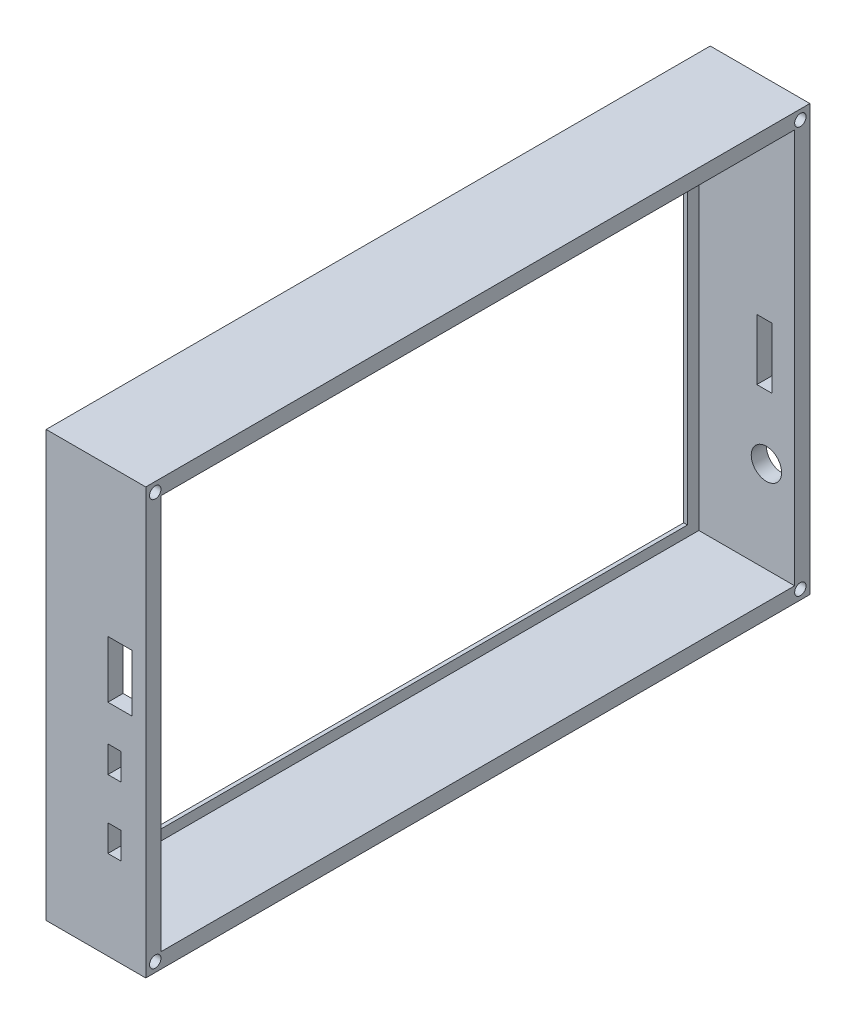
from build123d import *

# Parameters (mm, degrees)
CROQUIS1_W              = 164.9
CROQUIS1_H              = 102
SALIENTE_EXTRUIR2_DEPTH = 14.27
CROQUIS2_W              = 174.9
CROQUIS2_H              = 112
CROQUIS2_W_2            = 166.9
CROQUIS2_H_2            = 104
SALIENTE_EXTRUIR3_DEPTH = 14.27
CROQUIS3_W              = 174.9
CROQUIS3_H              = 112
CROQUIS3_W_2            = 160.9
CROQUIS3_H_2            = 98.374406292
SALIENTE_EXTRUIR5_DEPTH = 1
CROQUIS4_W              = 164.9
CROQUIS4_H              = 102
CORTAR_EXTRUIR2_DEPTH   = 14.27
CROQUIS6_W              = 174.9
CROQUIS6_H              = 112
CROQUIS6_R              = 1.5
SALIENTE_EXTRUIR6_DEPTH = 15
CROQUIS8_W              = 160.9
CROQUIS8_H              = 98.374406292
CORTAR_EXTRUIR3_DEPTH   = 9
CROQUIS9_W              = 166.9
CROQUIS9_H              = 104
CORTAR_EXTRUIR5_DEPTH   = 11
CROQUIS15_W             = 6.3
CROQUIS15_H             = 15
CROQUIS15_W_2           = 3.5
CROQUIS15_H_2           = 7
CORTAR_EXTRUIR6_DEPTH   = 7
CORTAR_EXTRUIR7_DEPTH   = 7
CROQUIS17_R             = 4
CORTAR_EXTRUIR8_DEPTH   = 7
CROQUIS18_W             = 4
CROQUIS18_H             = 16
CORTAR_EXTRUIR9_DEPTH   = 7
CROQUIS21_R             = 1.5
CORTAR_EXTRUIR12_DEPTH  = 25.4
CROQUIS22_W             = 4.034105038
CROQUIS22_H             = 112
CORTAR_EXTRUIR13_DEPTH  = 179.4


with BuildPart() as part:
    # Croquis1 → Saliente-Extruir2 (new body)
    with BuildSketch(Plane(origin=(0, 0, 0), x_dir=(0, 0, -1), z_dir=(1, 0, 0))):
        Rectangle(CROQUIS1_W, CROQUIS1_H)
    extrude(amount=SALIENTE_EXTRUIR2_DEPTH)

    # Croquis4 → Cortar-Extruir2 (cut)
    with BuildSketch(Plane(origin=(14.27, 0, 0), x_dir=(0, 0, -1), z_dir=(1, 0, 0))):
        Rectangle(CROQUIS4_W, CROQUIS4_H)
    extrude(amount=-CORTAR_EXTRUIR2_DEPTH, mode=Mode.SUBTRACT)


with BuildPart() as body_2:
    # Croquis2 → Saliente-Extruir3 (new body)
    with BuildSketch(Plane(origin=(0, 0, 0), x_dir=(0, 0, -1), z_dir=(1, 0, 0))):
        Rectangle(CROQUIS2_W, CROQUIS2_H)
        Rectangle(CROQUIS2_W_2, CROQUIS2_H_2, mode=Mode.SUBTRACT)
    extrude(amount=SALIENTE_EXTRUIR3_DEPTH)

    # Croquis3 → Saliente-Extruir5 (add)
    with BuildSketch(Plane.ZY):
        Rectangle(CROQUIS3_W, CROQUIS3_H)
        with Locations((0, -0.062203146)):
            Rectangle(CROQUIS3_W_2, CROQUIS3_H_2, mode=Mode.SUBTRACT)
    extrude(amount=SALIENTE_EXTRUIR5_DEPTH)

    # Croquis6 → Saliente-Extruir6 (add)
    with BuildSketch(Plane(origin=(14.27, 0, 0), x_dir=(0, 0, -1), z_dir=(1, 0, 0))):
        Rectangle(CROQUIS6_W, CROQUIS6_H)
        with Locations((-77.445, 46)):
            Circle(CROQUIS6_R, mode=Mode.SUBTRACT)
        with Locations((-77.445, -46)):
            Circle(CROQUIS6_R, mode=Mode.SUBTRACT)
        with Locations((-22.1, 15.81)):
            Circle(CROQUIS6_R, mode=Mode.SUBTRACT)
        with Locations((35.9, 15.81)):
            Circle(CROQUIS6_R, mode=Mode.SUBTRACT)
        with Locations((-22.1, -33.19)):
            Circle(CROQUIS6_R, mode=Mode.SUBTRACT)
        with Locations((35.9, -33.19)):
            Circle(CROQUIS6_R, mode=Mode.SUBTRACT)
        with Locations((77.445, 46)):
            Circle(CROQUIS6_R, mode=Mode.SUBTRACT)
        with Locations((77.445, -46)):
            Circle(CROQUIS6_R, mode=Mode.SUBTRACT)
    extrude(amount=SALIENTE_EXTRUIR6_DEPTH)

    # Croquis8 → Cortar-Extruir3 (cut)
    with BuildSketch(Plane.ZY.offset(-14.27)):
        with Locations((0, -0.062203146)):
            Rectangle(CROQUIS8_W, CROQUIS8_H)
    extrude(amount=-CORTAR_EXTRUIR3_DEPTH, mode=Mode.SUBTRACT)

    # Croquis9 → Cortar-Extruir5 (cut)
    with BuildSketch(Plane.ZY.offset(-14.27)):
        Rectangle(CROQUIS9_W, CROQUIS9_H)
    extrude(amount=-CORTAR_EXTRUIR5_DEPTH, mode=Mode.SUBTRACT)

    # Croquis15 → Cortar-Extruir6 (cut)
    with BuildSketch(Plane.XY.offset(87.45)):
        with Locations((18.42, 9.417324545)):
            Rectangle(CROQUIS15_W, CROQUIS15_H)
        with Locations((17.02, -11.082675455)):
            Rectangle(CROQUIS15_W_2, CROQUIS15_H_2)
        with Locations((17.02, -29.082675455)):
            Rectangle(CROQUIS15_W_2, CROQUIS15_H_2)
    extrude(amount=-CORTAR_EXTRUIR6_DEPTH, mode=Mode.SUBTRACT)

    # Croquis16 → Cortar-Extruir7 (cut)
    with BuildSketch(Plane(origin=(29.27, 0, 0), x_dir=(0, 0, -1), z_dir=(1, 0, 0))):
        with BuildLine():
            Line((-70.67585332, 19.450942007), (-40.125245351, 19.450942007))
            ThreePointArc((-40.125245351, 19.450942007), (-36.589711445, 20.915408101), (-35.125245351, 24.450942007))
            Line((-35.125245351, 24.450942007), (-35.125245351, 43.370497663))
            ThreePointArc((-35.125245351, 43.370497663), (-36.589711445, 46.906031569), (-40.125245351, 48.370497663))
            Line((-40.125245351, 48.370497663), (-70.67585332, 48.370497663))
            ThreePointArc((-70.67585332, 48.370497663), (-74.211387226, 46.906031569), (-75.67585332, 43.370497663))
            Line((-75.67585332, 43.370497663), (-75.67585332, 24.450942007))
            ThreePointArc((-75.67585332, 24.450942007), (-74.211387226, 20.915408101), (-70.67585332, 19.450942007))
        make_face()
        with BuildLine():
            Line((40.269537366, 19.465768949), (70.820145334, 19.465768949))
            ThreePointArc((70.820145334, 19.465768949), (74.35567924, 20.930235043), (75.820145334, 24.465768949))
            Line((75.820145334, 24.465768949), (75.820145334, 43.385324606))
            ThreePointArc((75.820145334, 43.385324606), (74.35567924, 46.920858512), (70.820145334, 48.385324606))
            Line((70.820145334, 48.385324606), (40.269537366, 48.385324606))
            ThreePointArc((40.269537366, 48.385324606), (36.73400346, 46.920858512), (35.269537366, 43.385324606))
            Line((35.269537366, 43.385324606), (35.269537366, 24.465768949))
            ThreePointArc((35.269537366, 24.465768949), (36.73400346, 20.930235043), (40.269537366, 19.465768949))
        make_face()
    extrude(amount=-CORTAR_EXTRUIR7_DEPTH, mode=Mode.SUBTRACT)

    # Croquis17 → Cortar-Extruir8 (cut)
    with BuildSketch(Plane(origin=(0, 0, -87.45), x_dir=(-1, 0, 0), z_dir=(0, 0, -1))):
        with Locations(Location((-17.79171335, -27.901665979, 0), (0, 0, 90))):
            Circle(CROQUIS17_R)
    extrude(amount=-CORTAR_EXTRUIR8_DEPTH, mode=Mode.SUBTRACT)

    # Croquis18 → Cortar-Extruir9 (cut)
    with BuildSketch(Plane(origin=(0, 0, -87.45), x_dir=(-1, 0, 0), z_dir=(0, 0, -1))):
        with Locations((-17.27, -3.082675455)):
            Rectangle(CROQUIS18_W, CROQUIS18_H)
    extrude(amount=-CORTAR_EXTRUIR9_DEPTH, mode=Mode.SUBTRACT)

    # Croquis21 → Cortar-Extruir12 (cut)
    with BuildSketch(Plane(origin=(29.27, 0, 0), x_dir=(0, 0, -1), z_dir=(1, 0, 0))):
        with Locations((-84.95, 53.5)):
            Circle(CROQUIS21_R)
        with Locations((84.95, 53.5)):
            Circle(CROQUIS21_R)
        with Locations((84.95, -53.5)):
            Circle(CROQUIS21_R)
        with Locations((-84.95, -53.5)):
            Circle(CROQUIS21_R)
    extrude(amount=-CORTAR_EXTRUIR12_DEPTH, mode=Mode.SUBTRACT)

    # Croquis22 → Cortar-Extruir13 (cut)
    with BuildSketch(Plane(origin=(0, 0, -87.45), x_dir=(-1, 0, 0), z_dir=(0, 0, -1))):
        with Locations((-27.252947481, 0)):
            Rectangle(CROQUIS22_W, CROQUIS22_H)
    extrude(amount=-CORTAR_EXTRUIR13_DEPTH, mode=Mode.SUBTRACT)


solid = body_2.part
